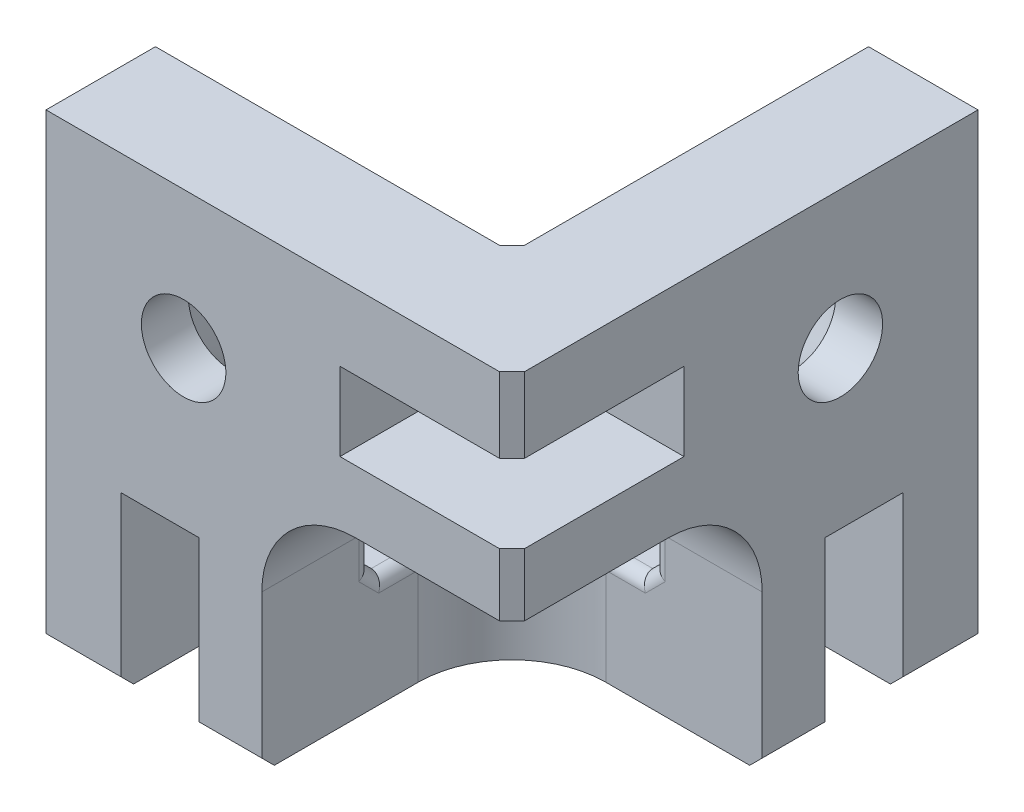
from build123d import *

# Parameters (mm, degrees)
ESQUISSE1_W                                        = 16
ESQUISSE1_H                                        = 16
BOSS_EXTRU_1_DEPTH                                 = 16
COQUE2_T                                           = -3.5
ESQUISSE2_W                                        = 2.5
ESQUISSE2_H                                        = 5.5
ESQUISSE2_W_2                                      = 5.5
ESQUISSE2_H_2                                      = 2.5
ENL_V_MAT_EXTRU_1_DEPTH                            = 5.5
ESQUISSE3_W                                        = 5.5
ESQUISSE3_H                                        = 2.5
ENL_V_MAT_EXTRU_2_DEPTH                            = 5.5
ENL_V_MAT_EXTRU_3_DEPTH                            = 3.5
ENL_V_MAT_EXTRU_4_DEPTH                            = 3.5
ENL_V_MAT_EXTRU_5_DEPTH                            = 3.5
FRAISAGE_POUR_VIS_T_TE_FRAIS_E_M2_51_D             = 2.7
FRAISAGE_POUR_VIS_T_TE_FRAIS_E_M2_51_CSINK_D       = 6.7
FRAISAGE_POUR_VIS_T_TE_FRAIS_E_M2_51_CSINK_ANGLE   = 90
FRAISAGE_POUR_VIS_T_TE_FRAIS_E_M2_51_O_D           = 2.7
FRAISAGE_POUR_VIS_T_TE_FRAIS_E_M2_51_O_CSINK_D     = 6.7
FRAISAGE_POUR_VIS_T_TE_FRAIS_E_M2_51_O_CSINK_ANGLE = 90
FRAISAGE_POUR_VIS_T_TE_FRAIS_E_M2_2_D              = 2.7
FRAISAGE_POUR_VIS_T_TE_FRAIS_E_M2_2_CSINK_D        = 6.7
FRAISAGE_POUR_VIS_T_TE_FRAIS_E_M2_2_CSINK_ANGLE    = 90
ENL_V_MAT_EXTRU_6_DEPTH                            = 1.1
ENL_V_MAT_EXTRU_7_DEPTH                            = 1.1
ENL_V_MAT_EXTRU_8_DEPTH                            = 1.1
CHANFREIN1_SIZE                                    = 0.4
CONG_1_R                                           = 0.4


with BuildPart() as part:
    # Esquisse1 → Boss.-Extru.1 (new body)
    with BuildSketch(Plane(origin=(0, 0, 0), x_dir=(1, 0, 0), z_dir=(0, 1, 0))):
        Rectangle(ESQUISSE1_W, ESQUISSE1_H)
    extrude(amount=BOSS_EXTRU_1_DEPTH)

    # Coque2
    coque2_openings = [part.faces().sort_by_distance(p)[0] for p in [
        (0, 16, 0),
        (-8, 8, 0),
        (0, 8, -8),
    ]]
    offset(amount=COQUE2_T, openings=coque2_openings, kind=Kind.INTERSECTION)

    # Esquisse2 → Enlèv. mat.-Extru.1 (cut)
    with BuildSketch(Plane.XZ):
        with Locations((-3.25, 5.25)):
            Rectangle(ESQUISSE2_W, ESQUISSE2_H)
        with Locations((5.25, -3.25)):
            Rectangle(ESQUISSE2_W_2, ESQUISSE2_H_2)
    extrude(amount=-ENL_V_MAT_EXTRU_1_DEPTH, mode=Mode.SUBTRACT)

    # Esquisse3 → Enlèv. mat.-Extru.2 (cut)
    with BuildSketch(Plane.XY.offset(8)):
        with Locations((5.25, 11.25)):
            Rectangle(ESQUISSE3_W, ESQUISSE3_H)
    extrude(amount=-ENL_V_MAT_EXTRU_2_DEPTH, mode=Mode.SUBTRACT)

    # Esquisse7 → Enlèv. mat.-Extru.3 (cut)
    with BuildSketch(Plane.XZ):
        with BuildLine():
            Line((3, 0), (8, 0))
            Line((8, 0), (8, 8))
            Line((8, 8), (0, 8))
            Line((0, 8), (0, 3))
            ThreePointArc((0, 3), (0.878679656, 0.878679656), (3, 0))
        make_face()
    extrude(amount=-ENL_V_MAT_EXTRU_3_DEPTH, mode=Mode.SUBTRACT)

    # Esquisse8 → Enlèv. mat.-Extru.4 (cut)
    with BuildSketch(Plane.XY.offset(8)):
        with BuildLine():
            Line((3, 8), (8, 8))
            Line((8, 8), (8, 0))
            Line((8, 0), (0, 0))
            Line((0, 0), (0, 5))
            ThreePointArc((0, 5), (0.878679656, 7.121320344), (3, 8))
        make_face()
    extrude(amount=-ENL_V_MAT_EXTRU_4_DEPTH, mode=Mode.SUBTRACT)

    # Esquisse9 → Enlèv. mat.-Extru.5 (cut)
    with BuildSketch(Plane(origin=(8, 0, 0), x_dir=(0, 0, -1), z_dir=(1, 0, 0))):
        with BuildLine():
            Line((-3, 8), (-8, 8))
            Line((-8, 8), (-8, 0))
            Line((-8, 0), (0, 0))
            Line((0, 0), (0, 5))
            ThreePointArc((0, 5), (-0.878679656, 7.121320344), (-3, 8))
        make_face()
    extrude(amount=-ENL_V_MAT_EXTRU_5_DEPTH, mode=Mode.SUBTRACT)

    # Fraisage pour vis à tête fraisée M2.51 (through all)
    with Locations(Plane(origin=(4.5, 10.5, -2.5), x_dir=(0, 0, -1), z_dir=(-1, 0, 0))):
        with Locations((0, 0)):
            CounterSinkHole(FRAISAGE_POUR_VIS_T_TE_FRAIS_E_M2_51_D / 2, FRAISAGE_POUR_VIS_T_TE_FRAIS_E_M2_51_CSINK_D / 2, counter_sink_angle=FRAISAGE_POUR_VIS_T_TE_FRAIS_E_M2_51_CSINK_ANGLE)

    # Fraisage pour vis à tête fraisée M2.51 o (through all)
    with Locations(Plane(origin=(-2.5, 10.5, 4.5), x_dir=(-1, 0, 0), z_dir=(0, 0, -1))):
        with Locations((0, 0)):
            CounterSinkHole(FRAISAGE_POUR_VIS_T_TE_FRAIS_E_M2_51_O_D / 2, FRAISAGE_POUR_VIS_T_TE_FRAIS_E_M2_51_O_CSINK_D / 2, counter_sink_angle=FRAISAGE_POUR_VIS_T_TE_FRAIS_E_M2_51_O_CSINK_ANGLE)

    # Fraisage pour vis _ t_te frais_e M2. 2 (through all)
    with Locations(Plane(origin=(-2.5, 3.5, -2.5), x_dir=(0, 0, 1), z_dir=(0, 1, 0))):
        with Locations((0, 0)):
            CounterSinkHole(FRAISAGE_POUR_VIS_T_TE_FRAIS_E_M2_2_D / 2, FRAISAGE_POUR_VIS_T_TE_FRAIS_E_M2_2_CSINK_D / 2, counter_sink_angle=FRAISAGE_POUR_VIS_T_TE_FRAIS_E_M2_2_CSINK_ANGLE)

    # Esquisse10 → Enlèv. mat.-Extru.6 (cut)
    with BuildSketch(Plane(origin=(0, 16, 0), x_dir=(1, 0, 0), z_dir=(0, 1, 0))):
        Polygon((4.5, 8), (4.5, -4.5), (-8, -4.5), (-8, -8), (8, -8), (8, 8), align=None)
    extrude(amount=-ENL_V_MAT_EXTRU_6_DEPTH, mode=Mode.SUBTRACT)

    # Esquisse11 → Enlèv. mat.-Extru.7 (cut)
    with BuildSketch(Plane(origin=(0, 0, -8), x_dir=(-1, 0, 0), z_dir=(0, 0, -1))):
        Polygon((-4.5, 14.9), (-8, 14.9), (-8, 0), (8, 0), (8, 3.5), (-4.5, 3.5), align=None)
    extrude(amount=-ENL_V_MAT_EXTRU_7_DEPTH, mode=Mode.SUBTRACT)

    # Esquisse13 → Enlèv. mat.-Extru.8 (cut)
    with BuildSketch(Plane.ZY.offset(8)):
        Polygon((-6.9, 3.5), (-6.9, 0), (8, 0), (8, 14.9), (4.5, 14.9), (4.5, 3.5), align=None)
    extrude(amount=-ENL_V_MAT_EXTRU_8_DEPTH, mode=Mode.SUBTRACT)

    # Chanfrein1
    chanfrein1_edges = [part.edges().sort_by_distance(p)[0] for p in [
        (4.5, 13.7, 4.5),
        (8, 13.7, 8),
        (-5.7, 3.5, 4.5),
        (-5.7, 0, 8),
        (4.5, 3.5, -5.7),
        (-1, 3.5, 4.5),
        (8, 0, -5.7),
        (-1, 0, 8),
        (4.5, 9, 4.5),
        (8, 9, 8),
        (4.5, 3.5, -1),
        (8, 0, -1),
    ]]
    chamfer(chanfrein1_edges, length=CHANFREIN1_SIZE)

    # Congé1
    cong_1_edges = [part.edges().sort_by_distance(p)[0] for p in [
        (0.878679656, 3.5, 0.878679656),
        (0, 4.45, 4.5),
        (0.878679656, 7.121320344, 4.5),
        (4.5, 8, 3.55),
        (4.5, 7.121320344, 0.878679656),
        (3.55, 8, 4.5),
        (4.5, 4.45, 0),
        (4.3, 8, 4.3),
        (0, 3.7, 4.3),
        (4.3, 3.7, 0),
        (0, 3.5, 3.55),
        (3.55, 3.5, 0),
    ]]
    fillet(cong_1_edges, radius=CONG_1_R)


solid = part.part
